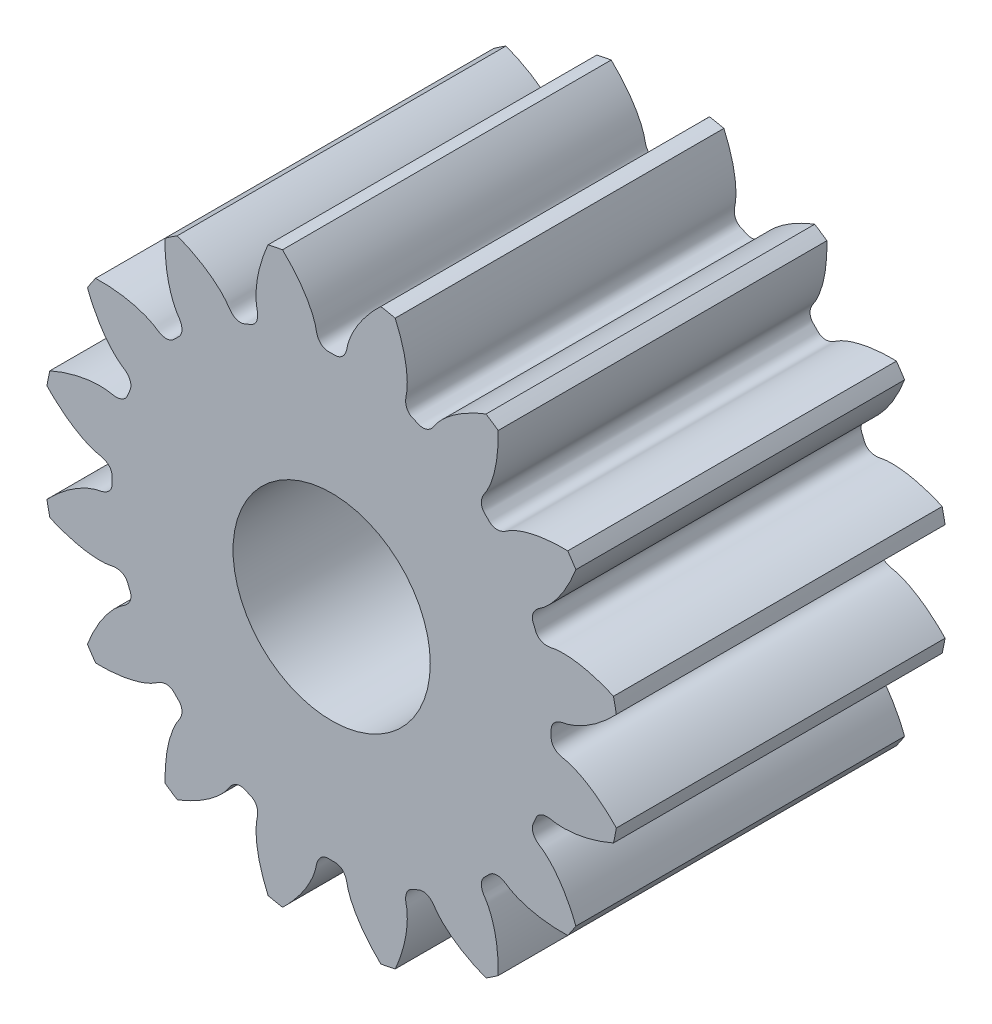
from build123d import *

# Parameters (mm, degrees)
SKETCHREVOLVESPURASSEMBLYNEW1PINION_W       = 10
SKETCHREVOLVESPURASSEMBLYNEW1PINION_H       = 8.7890625
TOOTHEXTRUDECUTSPURASSEMBLYNEW1PINION_START = -8
TOOTHEXTRUDECUTSPURASSEMBLYNEW1PINION_DEPTH = 12
PATTERNSPURASSEMBLYNEW1PINION_COUNT         = 16
SKETCH_1_R                                  = 3
CUT_EXTRUDE_1_DEPTH                         = 16.812131127


with BuildPart() as part:
    # SketchRevolveSpurAssemblyNew1Pinion → SpurAssemblyNew1Pinion (revolve)
    with BuildSketch(Plane(origin=(0, 0, 0), x_dir=(0, 0, -1), z_dir=(1, 0, 0))):
        with Locations((1, 4.39453125)):
            Rectangle(SKETCHREVOLVESPURASSEMBLYNEW1PINION_W, SKETCHREVOLVESPURASSEMBLYNEW1PINION_H)
    revolve(axis=Axis((0, 0, 0), (0, 0, -1)))

    # SketchToothSpurAssemblyNew1Pinion → ToothExtrudeCutSpurAssemblyNew1Pinion (cut)
    with BuildSketch(Plane.XY.offset(TOOTHEXTRUDECUTSPURASSEMBLYNEW1PINION_START)):
        with BuildLine():
            ThreePointArc((8.716029229, 1.554211503), (8.853515625, 0), (8.716029229, -1.554211503))
            add(Edge.make_bspline(
                [(8.716029229, -1.554211503), (8.62862713, -1.459312517), (8.49597106, -1.325274969), (8.314106298, -1.161849014), (8.18489776, -1.054323465), (8.059772215, -0.957996086), (7.9393825, -0.872392365), (7.82435095, -0.797004542), (7.71526784, -0.731293527), (7.612689882, -0.674690752), (7.517138975, -0.626599252), (7.429100479, -0.586397842), (7.349023414, -0.553435542), (7.277314902, -0.527057087), (7.214352885, -0.506532288), (7.160443959, -0.491276196), (7.097952634, -0.475750728), (7.046337113, -0.467920657), (7.004280637, -0.45783036), (6.985712313, -0.452872019), (6.967326671, -0.447394665), (6.949080273, -0.441357303), (6.930926481, -0.434695757), (6.912813897, -0.427331849), (6.894687768, -0.419165828), (6.876491766, -0.410072132), (6.858171606, -0.399892969), (6.839681201, -0.388431378), (6.82099277, -0.375443904), (6.802112664, -0.360634431), (6.783104949, -0.343651932), (6.764124314, -0.32409723), (6.745458017, -0.301546699), (6.727570244, -0.275603076), (6.711137767, -0.245982977), (6.69703376, -0.212637772), (6.686295044, -0.175893357), (6.680036417, -0.13805875), (6.677926166, -0.079083938), (6.68098156, 0), (6.677926166, 0.079083938), (6.680036417, 0.13805875), (6.686295044, 0.175893357), (6.69703376, 0.212637772), (6.711137767, 0.245982977), (6.727570244, 0.275603076), (6.745458017, 0.301546699), (6.764124314, 0.32409723), (6.783104949, 0.343651932), (6.802112664, 0.360634431), (6.82099277, 0.375443904), (6.839681201, 0.388431378), (6.858171606, 0.399892969), (6.876491766, 0.410072132), (6.894687768, 0.419165828), (6.912813897, 0.427331849), (6.930926481, 0.434695757), (6.949080273, 0.441357303), (6.967326671, 0.447394665), (6.985712313, 0.452872019), (7.004280637, 0.45783036), (7.046337113, 0.467920657), (7.097952634, 0.475750728), (7.160443959, 0.491276196), (7.214352885, 0.506532288), (7.277314902, 0.527057087), (7.349023414, 0.553435542), (7.429100479, 0.586397842), (7.517138975, 0.626599252), (7.612689882, 0.674690752), (7.71526784, 0.731293527), (7.82435095, 0.797004542), (7.9393825, 0.872392365), (8.059772215, 0.957996086), (8.18489776, 1.054323465), (8.314106298, 1.161849014), (8.49597106, 1.325274969), (8.62862713, 1.459312517), (8.716029229, 1.554211503)],
                knots=[0, 0, 0, 0, 0.071940146, 0.105070476, 0.136307645, 0.165651652, 0.193102497, 0.218660181, 0.242324703, 0.264096063, 0.283974262, 0.301959299, 0.318051175, 0.332249889, 0.344555442, 0.354967833, 0.363487062, 0.380444448, 0.384031118, 0.387599323, 0.39116026, 0.394726966, 0.398314667, 0.401941182, 0.405627388, 0.409397748, 0.413280862, 0.417309997, 0.421523496, 0.425964841, 0.430682071, 0.43572602, 0.44114668, 0.446986911, 0.453273001, 0.460002642, 0.467132884, 0.474573007, 0.481318675, 0.5, 0.518681325, 0.525426993, 0.532867116, 0.539997358, 0.546726999, 0.553013089, 0.55885332, 0.56427398, 0.569317929, 0.574035159, 0.578476504, 0.582690003, 0.586719138, 0.590602252, 0.594372612, 0.598058818, 0.601685333, 0.605273034, 0.60883974, 0.612400677, 0.615968882, 0.619555552, 0.636512938, 0.645032167, 0.655444558, 0.667750111, 0.681948825, 0.698040701, 0.716025738, 0.735903937, 0.757675297, 0.781339819, 0.806897503, 0.834348348, 0.863692355, 0.894929524, 0.928059854, 1, 1, 1, 1], degree=3))
        make_face()
    toothextrudecutspurassemblynew1pinion = extrude(amount=TOOTHEXTRUDECUTSPURASSEMBLYNEW1PINION_DEPTH, mode=Mode.SUBTRACT)

    # PatternSpurAssemblyNew1Pinion: ToothExtrudeCutSpurAssemblyNew1Pinion ×16 about axis
    patternspurassemblynew1pinion_axis = Axis((0, 0, 50), (0, 0, -1))
    for i in range(1, PATTERNSPURASSEMBLYNEW1PINION_COUNT):
        add(toothextrudecutspurassemblynew1pinion.rotate(patternspurassemblynew1pinion_axis, i * 360 / PATTERNSPURASSEMBLYNEW1PINION_COUNT), mode=Mode.SUBTRACT)

    # Эскиз1 → Вырез-Вытянуть1 (cut, through all)
    with BuildSketch(Plane.XY.offset(4)):
        Circle(SKETCH_1_R)
    extrude(amount=-CUT_EXTRUDE_1_DEPTH, mode=Mode.SUBTRACT)


solid = part.part
